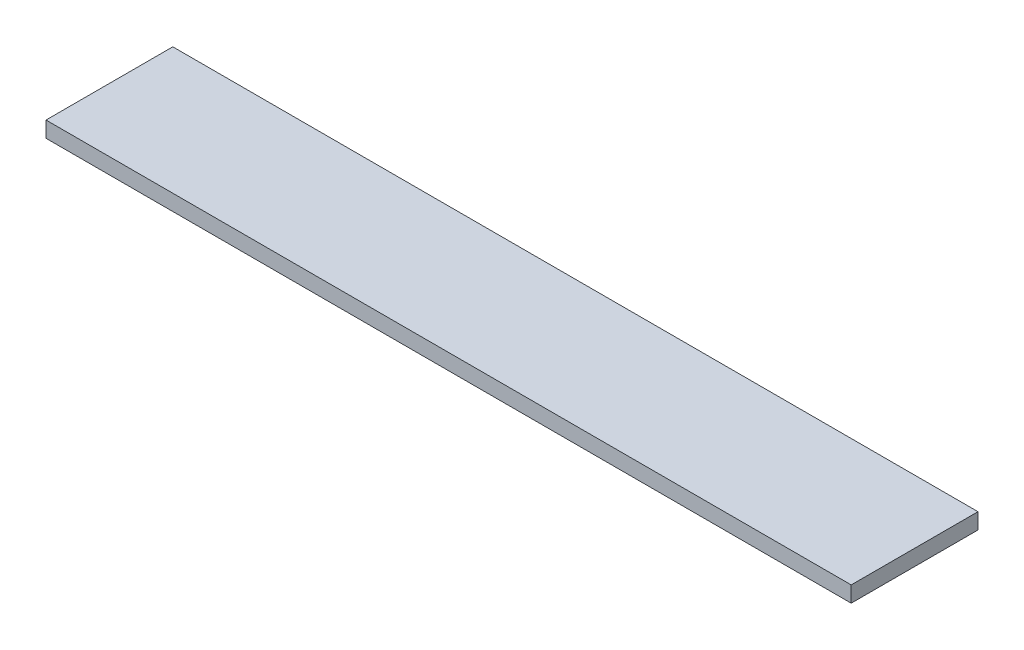
from build123d import *

# Parameters (mm, degrees)
SKETCH1_W           = 254
SKETCH1_H           = 40
BOSS_EXTRUDE1_DEPTH = 5


with BuildPart() as part:
    # Sketch1 → Boss-Extrude1 (new body)
    with BuildSketch(Plane(origin=(0, 0, 0), x_dir=(1, 0, 0), z_dir=(0, 1, 0))):
        Rectangle(SKETCH1_W, SKETCH1_H)
    extrude(amount=BOSS_EXTRUDE1_DEPTH)


solid = part.part
